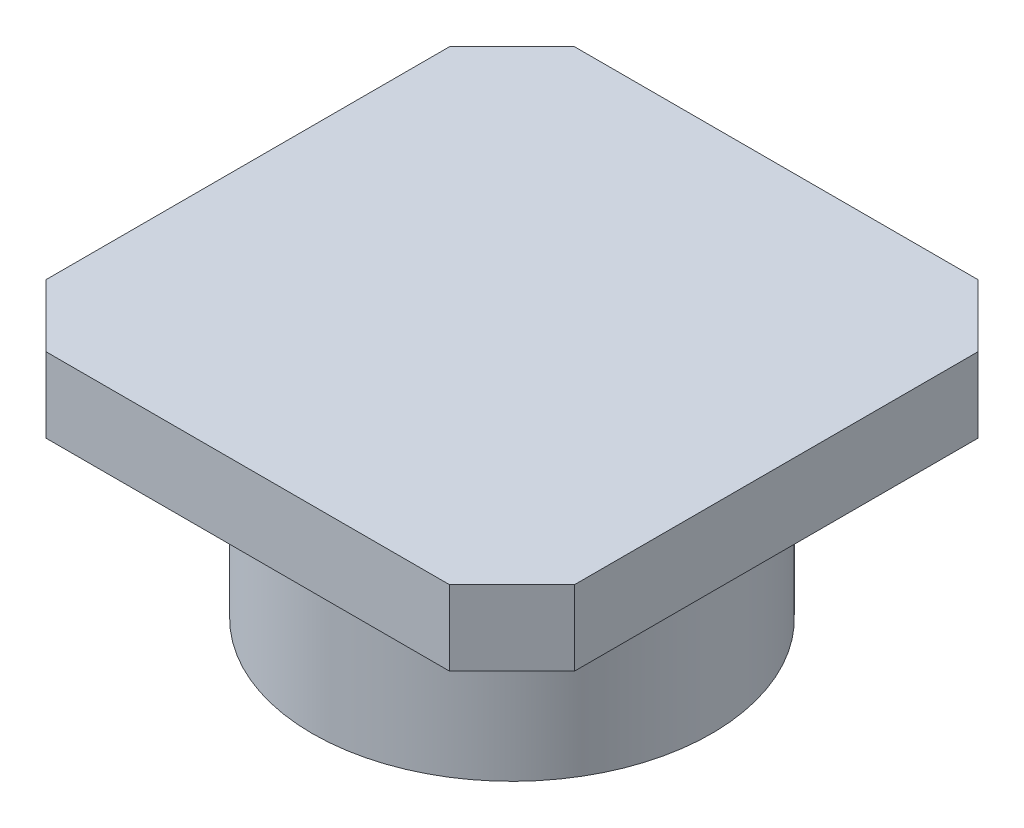
from build123d import *

# Parameters (mm, degrees)
SKETCH1_R          = 16
SKETCH1_R_2        = 12.5
EXTRUDE1_DEPTH     = 15
SKETCH2_R          = 30
EXTRUDE2_DEPTH     = 6
FILLET1_R          = 2
SKETCH5_W          = 68.7469374
SKETCH5_H          = 68.7469374
CUT_EXTRUDE2_DEPTH = 10


with BuildPart() as part:
    # Sketch1 → Extrude1 (new body)
    with BuildSketch(Plane(origin=(0, 0, 0), x_dir=(1, 0, 0), z_dir=(0, 1, 0))):
        with Locations(Location((0, 0, 0), (0, 0, 270))):
            Circle(SKETCH1_R)
        with Locations(Location((0, 0, 0), (0, 0, 270))):
            Circle(SKETCH1_R_2, mode=Mode.SUBTRACT)
    extrude(amount=EXTRUDE1_DEPTH)

    # Sketch2 → Extrude2 (add)
    with BuildSketch(Plane(origin=(0, 15, 0), x_dir=(1, 0, 0), z_dir=(0, 1, 0))):
        with Locations(Location((0, 0, 0), (0, 0, 270))):
            Circle(SKETCH2_R)
    extrude(amount=EXTRUDE2_DEPTH)

    # Fillet1
    fillet1_edges = [part.edges().sort_by_distance(p)[0] for p in [
        (0, 15, -16),
    ]]
    fillet(fillet1_edges, radius=FILLET1_R)

    # Sketch5 → Cut-Extrude2 (cut)
    with BuildSketch(Plane(origin=(0, 21, 0), x_dir=(1, 0, 0), z_dir=(0, 1, 0))):
        Rectangle(SKETCH5_W, SKETCH5_H)
        Polygon((-21.16926222, 16.16926222), (-16.16926222, 21.16926222), (16.16926222, 21.16926222), (21.16926222, 16.16926222), (21.16926222, -16.16926222), (16.16926222, -21.16926222), (-16.16926222, -21.16926222), (-21.16926222, -16.16926222), align=None, mode=Mode.SUBTRACT)
    extrude(amount=-CUT_EXTRUDE2_DEPTH, mode=Mode.SUBTRACT)


solid = part.part
